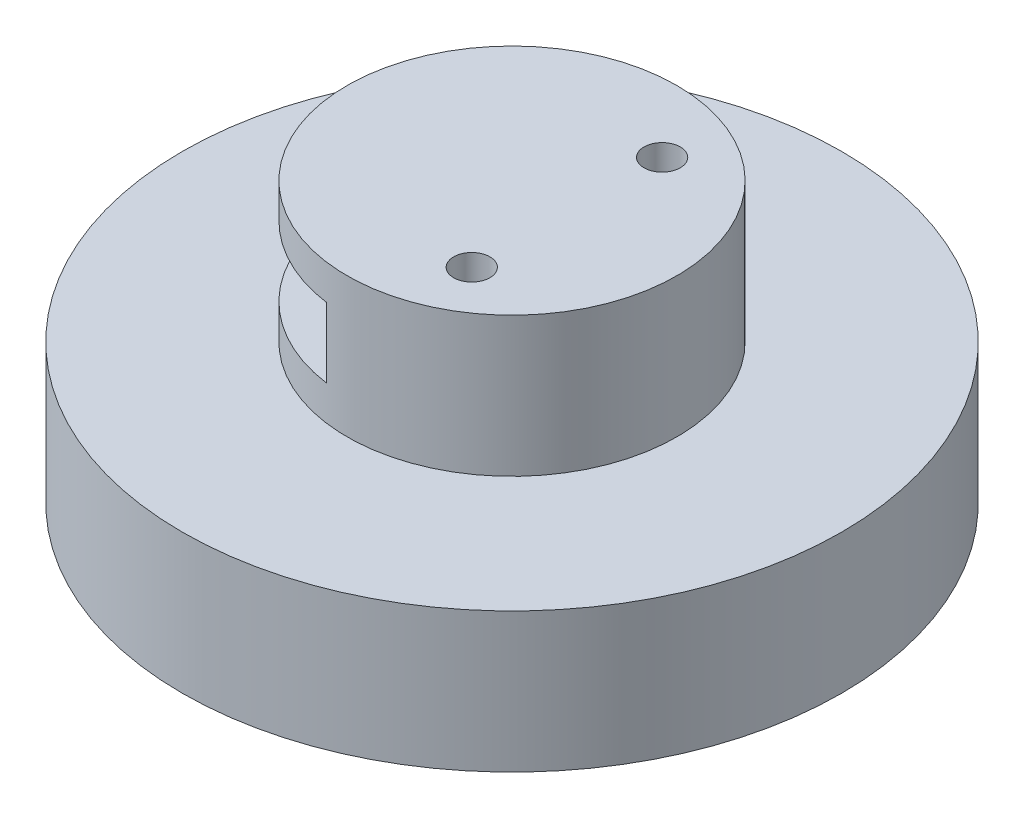
from build123d import *

# Parameters (mm, degrees)
CUT_EXTRUDE1_DEPTH        = 45.286453911
CUT_EXTRUDE1_DEPTH_BACK   = 45.286453911
SKETCH2_W                 = 13
SKETCH2_H                 = 6.35
M4X0_7_TAPPED_HOLE1_D     = 3.3
M4X0_7_TAPPED_HOLE1_DEPTH = 10.1
M4X0_7_TAPPED_HOLE1_TIP   = 0.991420021
M4X0_7_TAPPED_HOLE2_D     = 3.3
M4X0_7_TAPPED_HOLE2_DEPTH = 10.1
M4X0_7_TAPPED_HOLE2_TIP   = 0.991420021


with BuildPart() as part:
    # Sketch1 → Revolve1 (revolve)
    with BuildSketch(Plane.XY, mode=Mode.PRIVATE) as revolve1_sk:
        Polygon((0, 12.7), (-15, 12.7), (-15, 0), (-30, 0), (-30, -12.7), (0, -12.7), align=None)
    revolve(revolve1_sk.sketch.rotate(Axis((0, -12.7, 0), (0, 1, 0)), 270), axis=Axis((0, -12.7, 0), (0, 1, 0)))

    # Sketch2 → Cut-Extrude1 (cut, two sides: drawn at the far end of the back side and taken through both)
    with BuildSketch(Plane.XY.offset(-CUT_EXTRUDE1_DEPTH_BACK)):
        with Locations((-8.5, 6.35)):
            Rectangle(SKETCH2_W, SKETCH2_H)
    extrude(amount=CUT_EXTRUDE1_DEPTH + CUT_EXTRUDE1_DEPTH_BACK, mode=Mode.SUBTRACT)

    # M4x0.7 Tapped Hole1
    with Locations(Plane(origin=(0, 12.7, 0), x_dir=(1, 0, 0), z_dir=(0, 1, 0))):
        with Locations((5, -8.660254038), (5, 8.660254038)):
            Hole(M4X0_7_TAPPED_HOLE1_D / 2, depth=M4X0_7_TAPPED_HOLE1_DEPTH)
            with Locations((0, 0, -(M4X0_7_TAPPED_HOLE1_DEPTH + M4X0_7_TAPPED_HOLE1_TIP / 2))):  # 118° drill point
                Cone(0, M4X0_7_TAPPED_HOLE1_D / 2, M4X0_7_TAPPED_HOLE1_TIP, mode=Mode.SUBTRACT)

    # M4x0.7 Tapped Hole2
    with Locations(Plane(origin=(0, -12.7, 0), x_dir=(-1, 0, 0), z_dir=(0, -1, 0))):
        with Locations((-20, 0), (10, -17.320508076), (10, 17.320508076)):
            Hole(M4X0_7_TAPPED_HOLE2_D / 2, depth=M4X0_7_TAPPED_HOLE2_DEPTH)
            with Locations((0, 0, -(M4X0_7_TAPPED_HOLE2_DEPTH + M4X0_7_TAPPED_HOLE2_TIP / 2))):  # 118° drill point
                Cone(0, M4X0_7_TAPPED_HOLE2_D / 2, M4X0_7_TAPPED_HOLE2_TIP, mode=Mode.SUBTRACT)


solid = part.part
